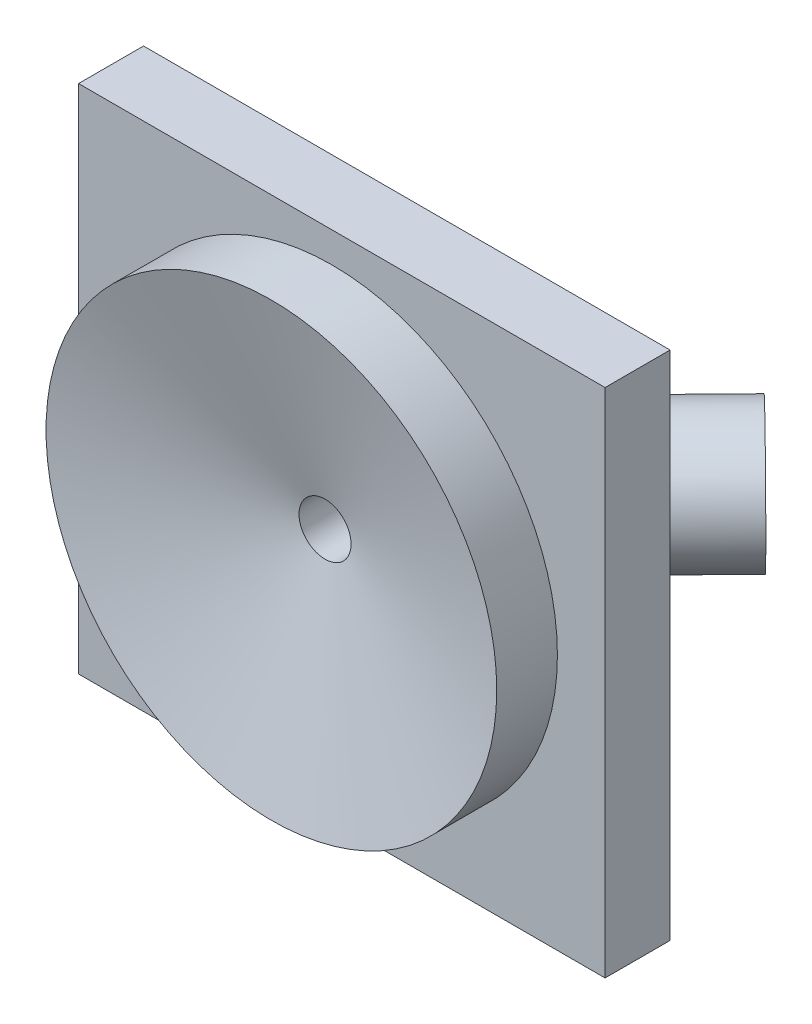
from build123d import *

# Parameters (mm, degrees)
SKETCH7_R           = 1.475
SKETCH10_W          = 12.15
SKETCH10_H          = 11.8
BOSS_EXTRUDE1_DEPTH = 1.5
SKETCH5_R           = 0.6


with BuildPart() as part:
    # Sketch1 → Revolve1 (revolve)
    with BuildSketch(Plane(origin=(0, 0, 0), x_dir=(1, 0, 0), z_dir=(0, 1, 0))):
        Polygon((27.31279509, 4.648041847), (32.51279509, 4.648041847), (32.51279509, 1.748041847), (27.31279509, 3.148041847), align=None)
    revolve(axis=Axis((27.31279509, 0, -3.148041847), (0, 0, -1)))

    # Sweep2: sweep along a path in Sketch8
    with BuildLine(Plane(origin=(0, 0, 0), x_dir=(1, 0, 0), z_dir=(0, 1, 0))) as sweep2_path:
        Line((31.555435777, 8.890682534), (27.41279509, 4.648041847))
        Line((27.41279509, 4.648041847), (27.41279509, 3.648041847))
    # Sketch7 → Sweep2 (sweep)
    with BuildSketch(Plane(origin=(0, 0, -4.648041847), x_dir=(-1, 0, 0), z_dir=(0, 0, -1))):
        with Locations((-27.31279509, 0)):
            Circle(SKETCH7_R)
    sweep(path=sweep2_path.line, transition=Transition.RIGHT)

    # Sketch10 → Boss-Extrude1 (add)
    with BuildSketch(Plane(origin=(0, 0, -4.648041847), x_dir=(-1, 0, 0), z_dir=(0, 0, -1))):
        with Locations((-27.53779509, 0)):
            Rectangle(SKETCH10_W, SKETCH10_H)
    extrude(amount=-BOSS_EXTRUDE1_DEPTH)

    # Cut-Sweep2: sweep along a path in Sketch9
    with BuildLine(Plane(origin=(0, 0, 0), x_dir=(1, 0, 0), z_dir=(0, 1, 0))) as cut_sweep2_path:
        Line((27.41279509, 0), (27.41279509, 4.648041847))
        Line((27.41279509, 4.648041847), (31.655435777, 8.890682534))
    # Sketch5 → Cut-Sweep2 (sweep, cut)
    with BuildSketch(Plane.XY):
        with Locations((27.31279509, 0)):
            Circle(SKETCH5_R)
    sweep(path=cut_sweep2_path.line, transition=Transition.RIGHT, mode=Mode.SUBTRACT)


solid = part.part
